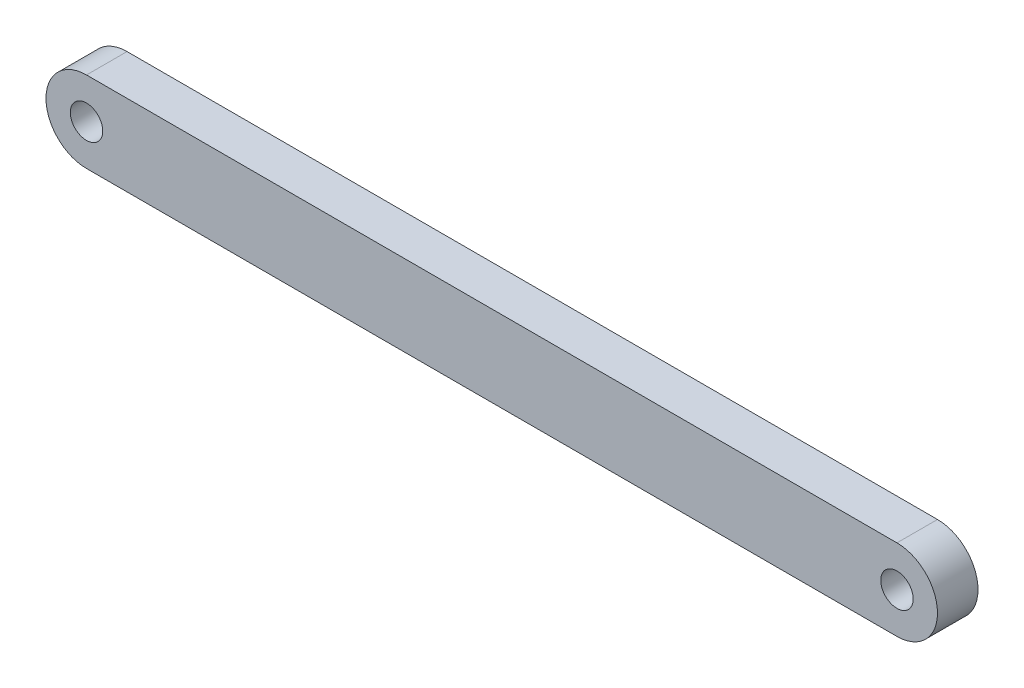
from build123d import *

# Parameters (mm, degrees)
BOSS_EXTRUDE1_DEPTH   = 5
F_8_0MM_DOWEL_HOLE1_D = 8


with BuildPart() as part:
    # Sketch1 → Boss-Extrude1 (new, symmetric)
    with BuildSketch(Plane.XY):
        with BuildLine():
            Line((-100, 10), (100, 10))
            ThreePointArc((100, 10), (110, 0), (100, -10))
            Line((100, -10), (-100, -10))
            ThreePointArc((-100, -10), (-110, 0), (-100, 10))
        make_face()
    extrude(amount=BOSS_EXTRUDE1_DEPTH, both=True)

    # Ø8.0mm Dowel Hole1 (through all)
    with Locations(Plane.XY.offset(5)):
        with Locations((-100, 0), (100, 0)):
            Hole(F_8_0MM_DOWEL_HOLE1_D / 2)


solid = part.part
